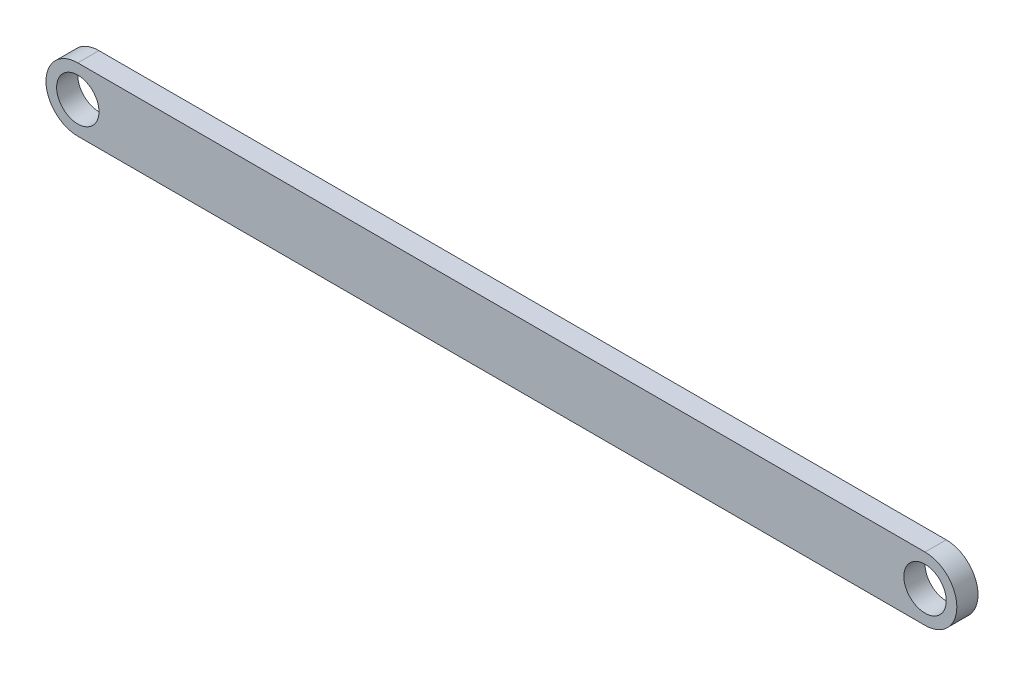
from build123d import *

# Parameters (mm, degrees)
SKETCH1_R           = 10
BOSS_EXTRUDE1_DEPTH = 10


with BuildPart() as part:
    # Sketch1 → Boss-Extrude1 (new body)
    with BuildSketch(Plane.XY):
        with BuildLine():
            Line((-192.931392931, 15), (207.068607069, 15))
            ThreePointArc((207.068607069, 15), (222.068607069, 0), (207.068607069, -15))
            Line((207.068607069, -15), (-192.931392931, -15))
            ThreePointArc((-192.931392931, -15), (-207.931392931, 0), (-192.931392931, 15))
        make_face()
        with Locations((-192.931392931, 0)):
            Circle(SKETCH1_R, mode=Mode.SUBTRACT)
        with Locations((207.068607069, 0)):
            Circle(SKETCH1_R, mode=Mode.SUBTRACT)
    extrude(amount=BOSS_EXTRUDE1_DEPTH)


solid = part.part
